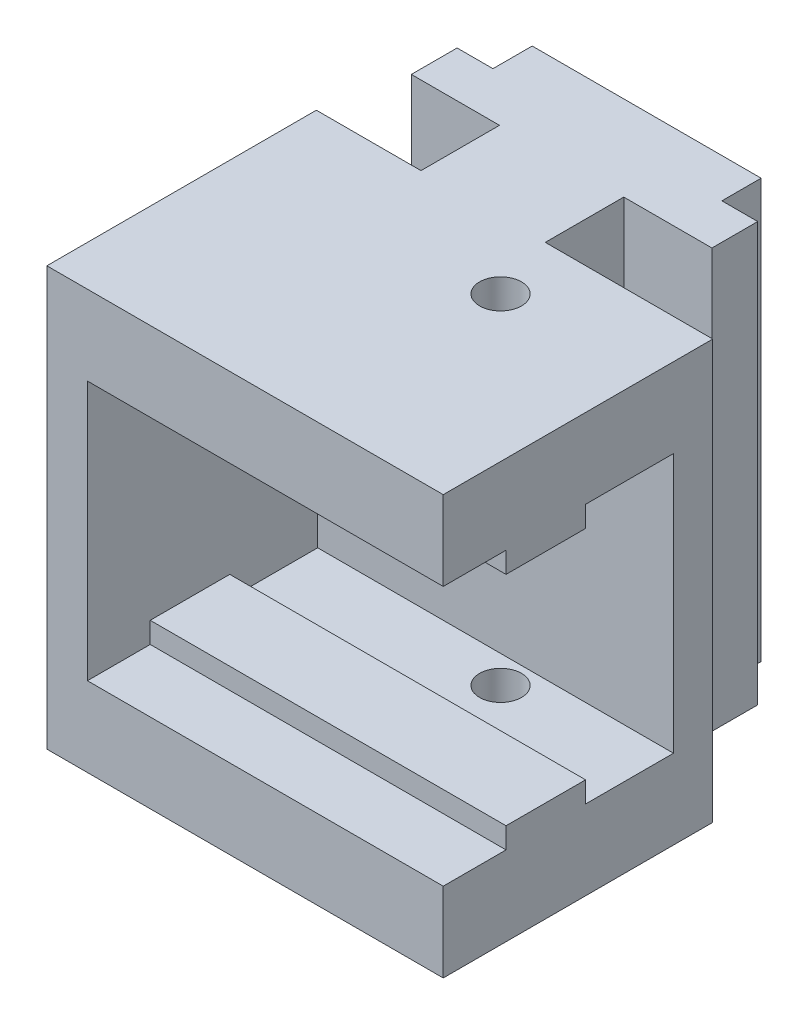
from build123d import *

# Parameters (mm, degrees)
SKETCH1_W           = 20.240625
SKETCH1_H           = 21.828125
BOSS_EXTRUDE1_DEPTH = 20.32
CUT_EXTRUDE1_DEPTH  = 20.32
SKETCH4_W           = 20.240625
SKETCH4_H           = 20.32
BOSS_EXTRUDE2_DEPTH = 4.445
BOSS_EXTRUDE3_DEPTH = 2.54
BOSS_EXTRUDE4_DEPTH = 2.54
SKETCH8_W           = 16.35125
SKETCH8_H           = 25.4
BOSS_EXTRUDE5_DEPTH = 7.62
SKETCH10_R          = 1.27
CUT_EXTRUDE3_DEPTH  = 35.580044657
CUT_EXTRUDE4_DEPTH  = 25.4
SKETCH14_W          = 16.35125
SKETCH14_H          = 25.4
CUT_EXTRUDE5_DEPTH  = 3.81


with BuildPart() as part:
    # Sketch1 → Boss-Extrude1 (new body)
    with BuildSketch(Plane(origin=(0, 0, 0), x_dir=(1, 0, 0), z_dir=(0, 1, 0))):
        Rectangle(SKETCH1_W, SKETCH1_H)
    extrude(amount=BOSS_EXTRUDE1_DEPTH)

    # Sketch2 → Cut-Extrude1 (cut)
    with BuildSketch(Plane(origin=(0, 20.32, 0), x_dir=(1, 0, 0), z_dir=(0, 1, 0))):
        Polygon((10.1203125, 0.9921875), (3.7703125, 0.9921875), (3.7703125, 5.7546875), (9.1203125, 5.7546875), (9.1203125, 8.5328125), (6.9453125, 8.5328125), (6.9453125, 10.9140625), (10.1203125, 10.9140625), (10.1203125, 8.5328125), (10.1203125, 5.7546875), align=None)
        Polygon((-6.9453125, 10.9140625), (-10.1203125, 10.9140625), (-10.1203125, 8.5328125), (-10.1203125, 5.7546875), (-10.1203125, 0.9921875), (-3.7703125, 0.9921875), (-3.7703125, 5.7546875), (-9.1203125, 5.7546875), (-9.1203125, 8.5328125), (-6.9453125, 8.5328125), align=None)
    extrude(amount=-CUT_EXTRUDE1_DEPTH, mode=Mode.SUBTRACT)

    # Sketch4 → Boss-Extrude2 (add)
    with BuildSketch(Plane.XY.offset(10.9140625)):
        with Locations((0, 10.16)):
            Rectangle(SKETCH4_W, SKETCH4_H)
    extrude(amount=BOSS_EXTRUDE2_DEPTH)

    # Sketch6 → Boss-Extrude3 (add)
    with BuildSketch(Plane(origin=(0, 20.32, 0), x_dir=(1, 0, 0), z_dir=(0, 1, 0))):
        Polygon((-10.1203125, -15.3590625), (-10.1203125, 0.9921875), (-3.7703125, 0.9921875), (-3.7703125, 5.7546875), (-9.1203125, 5.7546875), (-9.1203125, 8.5328125), (-6.9453125, 8.5328125), (-6.9453125, 10.9140625), (6.9453125, 10.9140625), (6.9453125, 8.5328125), (9.1203125, 8.5328125), (9.1203125, 5.7546875), (3.7703125, 5.7546875), (3.7703125, 0.9921875), (10.1203125, 0.9921875), (10.1203125, -15.3590625), align=None)
    extrude(amount=BOSS_EXTRUDE3_DEPTH)

    # Sketch7 → Boss-Extrude4 (add)
    with BuildSketch(Plane.XZ):
        Polygon((-10.1203125, -0.9921875), (-10.1203125, 15.3590625), (10.1203125, 15.3590625), (10.1203125, -0.9921875), (3.7703125, -0.9921875), (3.7703125, -5.7546875), (9.1203125, -5.7546875), (9.1203125, -8.5328125), (6.9453125, -8.5328125), (6.9453125, -10.9140625), (-6.9453125, -10.9140625), (-6.9453125, -8.5328125), (-9.1203125, -8.5328125), (-9.1203125, -5.7546875), (-3.7703125, -5.7546875), (-3.7703125, -0.9921875), align=None)
    extrude(amount=BOSS_EXTRUDE4_DEPTH)

    # Sketch8 → Boss-Extrude5 (add)
    with BuildSketch(Plane(origin=(10.1203125, 0, 0), x_dir=(0, 0, -1), z_dir=(1, 0, 0))):
        with Locations((-7.1834375, 10.16)):
            Rectangle(SKETCH8_W, SKETCH8_H)
    extrude(amount=BOSS_EXTRUDE5_DEPTH)

    # Sketch10 → Cut-Extrude3 (cut, through all)
    with BuildSketch(Plane.XZ.offset(2.54)):
        with Locations(Location((5.1196875, 3.0718125, 0), (0, 0, 270))):
            Circle(SKETCH10_R)
    extrude(amount=-CUT_EXTRUDE3_DEPTH, mode=Mode.SUBTRACT)

    # Sketch12 → Cut-Extrude4 (cut)
    with BuildSketch(Plane(origin=(17.7403125, 0, 0), x_dir=(0, 0, -1), z_dir=(1, 0, 0))):
        Polygon((-15.3590625, 18.034), (-15.3590625, 2.286), (-11.5490625, 2.286), (-11.5490625, 3.556), (-6.7230625, 3.556), (-6.7230625, 2.286), (-1.3890625, 2.286), (-1.3890625, 18.034), (-6.7230625, 18.034), (-6.7230625, 16.764), (-11.5490625, 16.764), (-11.5490625, 18.034), align=None)
    extrude(amount=-CUT_EXTRUDE4_DEPTH, mode=Mode.SUBTRACT)

    # Sketch14 → Cut-Extrude5 (cut)
    with BuildSketch(Plane(origin=(17.7403125, 0, 0), x_dir=(0, 0, -1), z_dir=(1, 0, 0))):
        with Locations((-7.1834375, 10.16)):
            Rectangle(SKETCH14_W, SKETCH14_H)
    extrude(amount=-CUT_EXTRUDE5_DEPTH, mode=Mode.SUBTRACT)


solid = part.part
